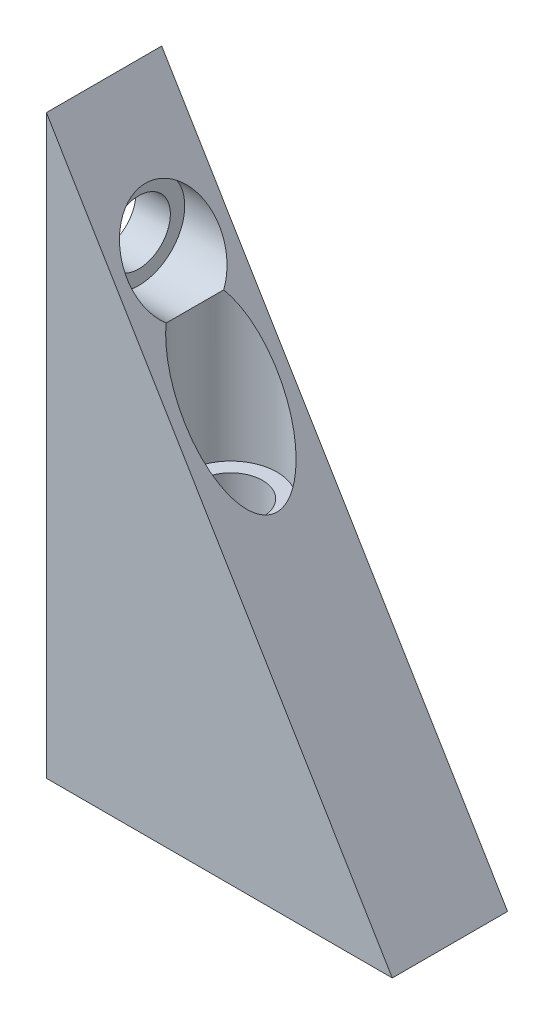
from build123d import *

# Parameters (mm, degrees)
EXTRUDE_1_DEPTH     = 10
SKETCH_2_R          = 2.75
CUT_EXTRUDE_1_DEPTH = 60.160797831
SKETCH_3_R          = 2.75
CUT_EXTRUDE_2_DEPTH = 60.160797831
SKETCH_4_R          = 4
CUT_EXTRUDE_3_DEPTH = 26
SKETCH_5_R          = 4
CUT_EXTRUDE_4_DEPTH = 27


with BuildPart() as part:
    # 草图1 → 凸台-拉伸1 (new body)
    with BuildSketch(Plane.XY):
        Polygon((0, 0), (0, 50), (30, 0), align=None)
    extrude(amount=EXTRUDE_1_DEPTH)

    # 草图2 → 切除-拉伸1 (cut, through all)
    with BuildSketch(Plane.XZ):
        with Locations(Location((11, 5, 0), (0, 0, 270))):
            Circle(SKETCH_2_R)
    extrude(amount=-CUT_EXTRUDE_1_DEPTH, mode=Mode.SUBTRACT)

    # 草图3 → 切除-拉伸2 (cut, through all)
    with BuildSketch(Plane.ZY):
        with Locations((5, 40)):
            Circle(SKETCH_3_R)
    extrude(amount=-CUT_EXTRUDE_2_DEPTH, mode=Mode.SUBTRACT)

    # 草图4 → 切除-拉伸3 (cut)
    with BuildSketch(Plane(origin=(0, 50, 0), x_dir=(-1, 0, 0), z_dir=(0, -1, 0))):
        with Locations(Location((-11, -5, 0), (0, 0, 336.277210116))):
            Circle(SKETCH_4_R)
    extrude(amount=CUT_EXTRUDE_3_DEPTH, mode=Mode.SUBTRACT)

    # 草图5 → 切除-拉伸4 (cut)
    with BuildSketch(Plane.ZY.offset(-30)):
        with Locations(Location((5, 40, 0), (0, 0, 231.375167127))):
            Circle(SKETCH_5_R)
    extrude(amount=CUT_EXTRUDE_4_DEPTH, mode=Mode.SUBTRACT)


solid = part.part
